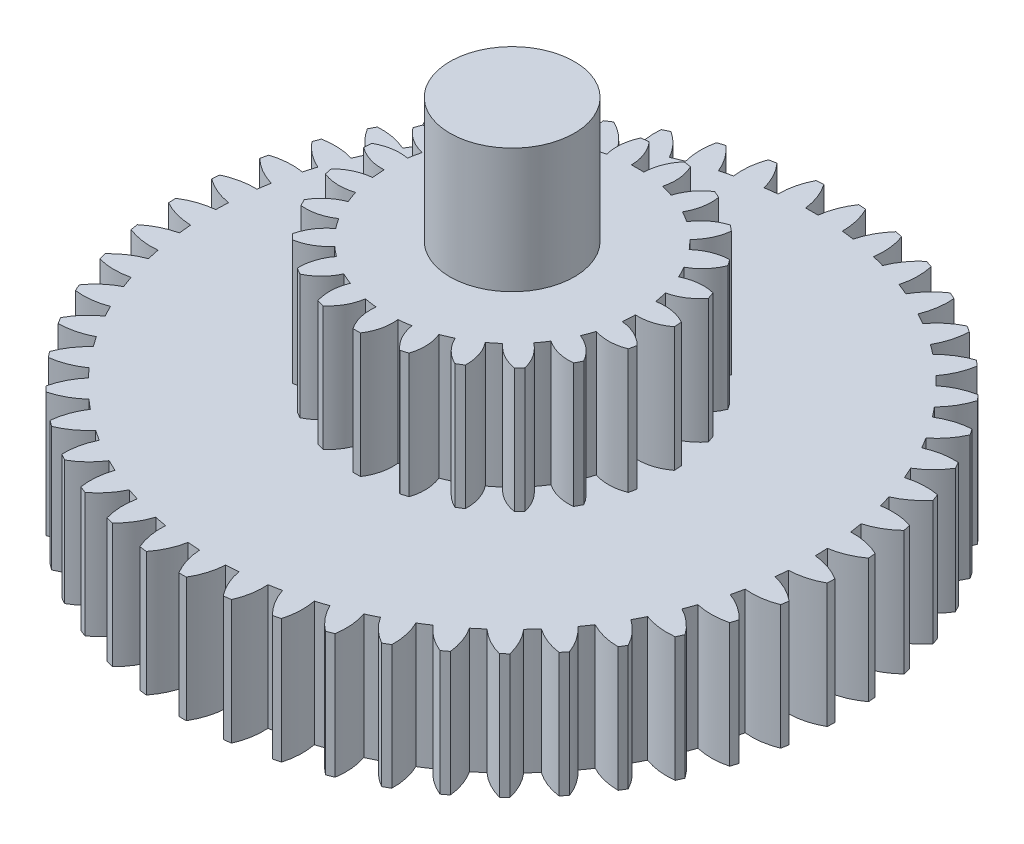
from build123d import *

# Parameters (mm, degrees)
BOSS_EXTRUDE1_DEPTH      = 1
BOSS_EXTRUDE2_DEPTH      = 2
BOSS_EXTRUDE2_DEPTH_BACK = 2
SKETCH2_R                = 0.5
BOSS_EXTRUDE3_DEPTH      = 1


with BuildPart() as part:
    # Sketch1 → Boss-Extrude1 (new body)
    with BuildSketch(Plane(origin=(0, 0, 0), x_dir=(1, 0, 0), z_dir=(0, 1, 0))):
        with BuildLine():
            ThreePointArc((-2.476479155, 0.943160111), (-2.486941318, 0.915217394), (-2.497088209, 0.887158654))
            ThreePointArc((-2.497088209, 0.887158654), (-2.405681699, 0.798131231), (-2.295665859, 0.733497284))
            ThreePointArc((-2.295665859, 0.733497284), (-2.310389526, 0.685711484), (-2.324118617, 0.637630499))
            ThreePointArc((-2.324118617, 0.637630499), (-2.451581658, 0.643479038), (-2.576755933, 0.618731655))
            ThreePointArc((-2.576755933, 0.618731655), (-2.583558967, 0.589680475), (-2.59003448, 0.560554541))
            ThreePointArc((-2.59003448, 0.560554541), (-2.487993842, 0.483946837), (-2.370616024, 0.433912047))
            ThreePointArc((-2.370616024, 0.433912047), (-2.379108098, 0.384635747), (-2.386576014, 0.335193869))
            ThreePointArc((-2.386576014, 0.335193869), (-2.513740479, 0.324694779), (-2.63472245, 0.284143641))
            ThreePointArc((-2.63472245, 0.284143641), (-2.637754649, 0.254461019), (-2.640452456, 0.224746138))
            ThreePointArc((-2.640452456, 0.224746138), (-2.529453195, 0.161816049), (-2.406640741, 0.127201987))
            ThreePointArc((-2.406640741, 0.127201987), (-2.408761781, 0.077244302), (-2.409845898, 0.027253365))
            ThreePointArc((-2.409845898, 0.027253365), (-2.534623752, 0.000579042), (-2.649426898, -0.055110003))
            ThreePointArc((-2.649426898, -0.055110003), (-2.648638473, -0.084936681), (-2.647514276, -0.114752591))
            ThreePointArc((-2.647514276, -0.114752591), (-2.529378996, -0.162971754), (-2.403148482, -0.181596727))
            ThreePointArc((-2.403148482, -0.181596727), (-2.398863662, -0.231415492), (-2.39354618, -0.281134638))
            ThreePointArc((-2.39354618, -0.281134638), (-2.513888572, -0.323546203), (-2.620627829, -0.393458742))
            ThreePointArc((-2.620627829, -0.393458742), (-2.616031726, -0.422939722), (-2.611103985, -0.452367085))
            ThreePointArc((-2.611103985, -0.452367085), (-2.487772464, -0.485083565), (-2.360196593, -0.487413627))
            ThreePointArc((-2.360196593, -0.487413627), (-2.349576268, -0.536275451), (-2.337944499, -0.584906419))
            ThreePointArc((-2.337944499, -0.584906419), (-2.451875411, -0.642358829), (-2.548798124, -0.7253469))
            ThreePointArc((-2.548798124, -0.7253469), (-2.540469811, -0.753998105), (-2.531819439, -0.782553724))
            ThreePointArc((-2.531819439, -0.782553724), (-2.405316777, -0.799230317), (-2.27849034, -0.78522721))
            ThreePointArc((-2.27849034, -0.78522721), (-2.261708897, -0.832329781), (-2.243953835, -0.879074052))
            ThreePointArc((-2.243953835, -0.879074052), (-2.349602524, -0.95062394), (-2.435117223, -1.045324882))
            ThreePointArc((-2.435117223, -1.045324882), (-2.423193451, -1.072675859), (-2.410962487, -1.099890852))
            ThreePointArc((-2.410962487, -1.099890852), (-2.283365855, -1.100253729), (-2.159371339, -1.070147383))
            ThreePointArc((-2.159371339, -1.070147383), (-2.136704328, -1.114717279), (-2.11311751, -1.158807313))
            ThreePointArc((-2.11311751, -1.158807313), (-2.208749229, -1.243279832), (-2.281451766, -1.348138658))
            ThreePointArc((-2.281451766, -1.348138658), (-2.266128322, -1.373740306), (-2.250517598, -1.399167803))
            ThreePointArc((-2.250517598, -1.399167803), (-2.123922129, -1.383211006), (-2.00479552, -1.337495765))
            ThreePointArc((-2.00479552, -1.337495765), (-1.976615134, -1.378801151), (-1.947583854, -1.419512991))
            ThreePointArc((-1.947583854, -1.419512991), (-2.031628332, -1.515521104), (-2.090324933, -1.628816034))
            ThreePointArc((-2.090324933, -1.628816034), (-2.071853429, -1.652247975), (-2.053119272, -1.675470458))
            ThreePointArc((-2.053119272, -1.675470458), (-1.92960366, -1.643455996), (-1.817301015, -1.582882504))
            ThreePointArc((-1.817301015, -1.582882504), (-1.784069973, -1.620245146), (-1.750070925, -1.656910304))
            ThreePointArc((-1.750070925, -1.656910304), (-1.821148154, -1.762877562), (-1.864875023, -1.882748297))
            ThreePointArc((-1.864875023, -1.882748297), (-1.843558759, -1.903625778), (-1.822008785, -1.924261933))
            ThreePointArc((-1.822008785, -1.924261933), (-1.703601153, -1.876715485), (-1.599966476, -1.802278357))
            ThreePointArc((-1.599966476, -1.802278357), (-1.562230433, -1.83508476), (-1.523821881, -1.867101196))
            ThreePointArc((-1.523821881, -1.867101196), (-1.580764774, -1.981287618), (-1.608803916, -2.105765884))
            ThreePointArc((-1.608803916, -2.105765884), (-1.584992906, -2.123746098), (-1.560980963, -2.141457081))
            ThreePointArc((-1.560980963, -2.141457081), (-1.449625561, -2.079159357), (-1.356360533, -1.992080848))
            ThreePointArc((-1.356360533, -1.992080848), (-1.314739112, -2.019792333), (-1.272551722, -2.046634338))
            ThreePointArc((-1.272551722, -2.046634338), (-1.31442528, -2.167164987), (-1.326316294, -2.294206854))
            ThreePointArc((-1.326316294, -2.294206854), (-1.300401513, -2.308994566), (-1.274321878, -2.323489563))
            ThreePointArc((-1.274321878, -2.323489563), (-1.171847158, -2.247463489), (-1.090483187, -2.149173427))
            ThreePointArc((-1.090483187, -2.149173427), (-1.045659811, -2.171334972), (-1.0003863, -2.192561801))
            ThreePointArc((-1.0003863, -2.192561801), (-1.026502959, -2.317457566), (-1.022050595, -2.44497701))
            ThreePointArc((-1.022050595, -2.44497701), (-0.994457563, -2.456329407), (-0.966738462, -2.467370411))
            ThreePointArc((-0.966738462, -2.467370411), (-0.874827057, -2.378864334), (-0.806700137, -2.270976638))
            ThreePointArc((-0.806700137, -2.270976638), (-0.759410805, -2.28722435), (-0.711794563, -2.302487459))
            ThreePointArc((-0.711794563, -2.302487459), (-0.721725488, -2.429697557), (-0.701002853, -2.555600712))
            ThreePointArc((-0.701002853, -2.555600712), (-0.672184647, -2.563331387), (-0.643281228, -2.570737105))
            ThreePointArc((-0.643281228, -2.570737105), (-0.56344232, -2.471204291), (-0.509671094, -2.355490475))
            ThreePointArc((-0.509671094, -2.355490475), (-0.460692295, -2.365557568), (-0.411515178, -2.374606338))
            ThreePointArc((-0.411515178, -2.374606338), (-0.405097304, -2.50204198), (-0.368444664, -2.624261521))
            ThreePointArc((-0.368444664, -2.624261521), (-0.338874478, -2.628243537), (-0.309261333, -2.631892366))
            ThreePointArc((-0.309261333, -2.631892366), (-0.242805876, -2.522967143), (-0.204273265, -2.401327223))
            ThreePointArc((-0.204273265, -2.401327223), (-0.15440923, -2.405048397), (-0.104478725, -2.407734245))
            ThreePointArc((-0.104478725, -2.407734245), (-0.081817434, -2.533302944), (-0.029836623, -2.649832028))
            ThreePointArc((-0.029836623, -2.649832028), (0, -2.65), (0.029836623, -2.649832028))
            ThreePointArc((0.029836623, -2.649832028), (0.081817434, -2.533302944), (0.104478725, -2.407734245))
            ThreePointArc((0.104478725, -2.407734245), (0.15440923, -2.405048397), (0.204273265, -2.401327223))
            ThreePointArc((0.204273265, -2.401327223), (0.242805876, -2.522967143), (0.309261333, -2.631892366))
            ThreePointArc((0.309261333, -2.631892366), (0.338874478, -2.628243537), (0.368444664, -2.624261521))
            ThreePointArc((0.368444664, -2.624261521), (0.405097304, -2.50204198), (0.411515178, -2.374606338))
            ThreePointArc((0.411515178, -2.374606338), (0.460692295, -2.365557568), (0.509671094, -2.355490475))
            ThreePointArc((0.509671094, -2.355490475), (0.56344232, -2.471204291), (0.643281228, -2.570737105))
            ThreePointArc((0.643281228, -2.570737105), (0.672184647, -2.563331387), (0.701002853, -2.555600712))
            ThreePointArc((0.701002853, -2.555600712), (0.721725488, -2.429697557), (0.711794563, -2.302487459))
            ThreePointArc((0.711794563, -2.302487459), (0.759410805, -2.28722435), (0.806700137, -2.270976638))
            ThreePointArc((0.806700137, -2.270976638), (0.874827057, -2.378864334), (0.966738462, -2.467370411))
            ThreePointArc((0.966738462, -2.467370411), (0.994457563, -2.456329407), (1.022050595, -2.44497701))
            ThreePointArc((1.022050595, -2.44497701), (1.026502959, -2.317457566), (1.0003863, -2.192561801))
            ThreePointArc((1.0003863, -2.192561801), (1.045659811, -2.171334972), (1.090483187, -2.149173427))
            ThreePointArc((1.090483187, -2.149173427), (1.171847158, -2.247463489), (1.274321878, -2.323489563))
            ThreePointArc((1.274321878, -2.323489563), (1.300401513, -2.308994566), (1.326316294, -2.294206854))
            ThreePointArc((1.326316294, -2.294206854), (1.31442528, -2.167164987), (1.272551722, -2.046634338))
            ThreePointArc((1.272551722, -2.046634338), (1.314739112, -2.019792333), (1.356360533, -1.992080848))
            ThreePointArc((1.356360533, -1.992080848), (1.449625561, -2.079159357), (1.560980963, -2.141457081))
            ThreePointArc((1.560980963, -2.141457081), (1.584992906, -2.123746098), (1.608803916, -2.105765884))
            ThreePointArc((1.608803916, -2.105765884), (1.580764774, -1.981287618), (1.523821881, -1.867101196))
            ThreePointArc((1.523821881, -1.867101196), (1.562230433, -1.83508476), (1.599966476, -1.802278357))
            ThreePointArc((1.599966476, -1.802278357), (1.703601153, -1.876715485), (1.822008785, -1.924261933))
            ThreePointArc((1.822008785, -1.924261933), (1.843558759, -1.903625778), (1.864875023, -1.882748297))
            ThreePointArc((1.864875023, -1.882748297), (1.821148154, -1.762877562), (1.750070925, -1.656910304))
            ThreePointArc((1.750070925, -1.656910304), (1.784069973, -1.620245146), (1.817301015, -1.582882504))
            ThreePointArc((1.817301015, -1.582882504), (1.92960366, -1.643455996), (2.053119272, -1.675470458))
            ThreePointArc((2.053119272, -1.675470458), (2.071853429, -1.652247975), (2.090324933, -1.628816034))
            ThreePointArc((2.090324933, -1.628816034), (2.031628332, -1.515521104), (1.947583854, -1.419512991))
            ThreePointArc((1.947583854, -1.419512991), (1.976615134, -1.378801151), (2.00479552, -1.337495765))
            ThreePointArc((2.00479552, -1.337495765), (2.123922129, -1.383211006), (2.250517598, -1.399167803))
            ThreePointArc((2.250517598, -1.399167803), (2.266128322, -1.373740306), (2.281451766, -1.348138658))
            ThreePointArc((2.281451766, -1.348138658), (2.208749229, -1.243279832), (2.11311751, -1.158807313))
            ThreePointArc((2.11311751, -1.158807313), (2.136704328, -1.114717279), (2.159371339, -1.070147383))
            ThreePointArc((2.159371339, -1.070147383), (2.283365855, -1.100253729), (2.410962487, -1.099890852))
            ThreePointArc((2.410962487, -1.099890852), (2.423193451, -1.072675859), (2.435117223, -1.045324882))
            ThreePointArc((2.435117223, -1.045324882), (2.349602524, -0.95062394), (2.243953835, -0.879074052))
            ThreePointArc((2.243953835, -0.879074052), (2.261708897, -0.832329781), (2.27849034, -0.78522721))
            ThreePointArc((2.27849034, -0.78522721), (2.405316777, -0.799230317), (2.531819439, -0.782553724))
            ThreePointArc((2.531819439, -0.782553724), (2.540469811, -0.753998105), (2.548798124, -0.7253469))
            ThreePointArc((2.548798124, -0.7253469), (2.451875411, -0.642358829), (2.337944499, -0.584906419))
            ThreePointArc((2.337944499, -0.584906419), (2.349576268, -0.536275451), (2.360196593, -0.487413627))
            ThreePointArc((2.360196593, -0.487413627), (2.487772464, -0.485083565), (2.611103985, -0.452367085))
            ThreePointArc((2.611103985, -0.452367085), (2.616031726, -0.422939722), (2.620627829, -0.393458742))
            ThreePointArc((2.620627829, -0.393458742), (2.513888572, -0.323546203), (2.39354618, -0.281134638))
            ThreePointArc((2.39354618, -0.281134638), (2.398863662, -0.231415492), (2.403148482, -0.181596727))
            ThreePointArc((2.403148482, -0.181596727), (2.529378996, -0.162971754), (2.647514276, -0.114752591))
            ThreePointArc((2.647514276, -0.114752591), (2.648638473, -0.084936681), (2.649426898, -0.055110003))
            ThreePointArc((2.649426898, -0.055110003), (2.534623752, 0.000579042), (2.409845898, 0.027253365))
            ThreePointArc((2.409845898, 0.027253365), (2.408761781, 0.077244302), (2.406640741, 0.127201987))
            ThreePointArc((2.406640741, 0.127201987), (2.529453195, 0.161816049), (2.640452456, 0.224746138))
            ThreePointArc((2.640452456, 0.224746138), (2.637754649, 0.254461019), (2.63472245, 0.284143641))
            ThreePointArc((2.63472245, 0.284143641), (2.513740479, 0.324694779), (2.386576014, 0.335193869))
            ThreePointArc((2.386576014, 0.335193869), (2.379108098, 0.384635747), (2.370616024, 0.433912047))
            ThreePointArc((2.370616024, 0.433912047), (2.487993842, 0.483946837), (2.59003448, 0.560554541))
            ThreePointArc((2.59003448, 0.560554541), (2.583558967, 0.589680475), (2.576755933, 0.618731655))
            ThreePointArc((2.576755933, 0.618731655), (2.451581658, 0.643479038), (2.324118617, 0.637630499))
            ThreePointArc((2.324118617, 0.637630499), (2.310389526, 0.685711484), (2.295665859, 0.733497284))
            ThreePointArc((2.295665859, 0.733497284), (2.405681699, 0.798131231), (2.497088209, 0.887158654))
            ThreePointArc((2.497088209, 0.887158654), (2.486941318, 0.915217394), (2.476479155, 0.943160111))
            ThreePointArc((2.476479155, 0.943160111), (2.349167934, 0.951697388), (2.223499257, 0.929597253))
            ThreePointArc((2.223499257, 0.929597253), (2.203734421, 0.975527857), (2.183020923, 1.021038516))
            ThreePointArc((2.183020923, 1.021038516), (2.283868329, 1.099210332), (2.363139819, 1.199195646))
            ThreePointArc((2.363139819, 1.199195646), (2.349488162, 1.225726469), (2.335538657, 1.252101905))
            ThreePointArc((2.335538657, 1.252101905), (2.208180937, 1.244288893), (2.086370101, 1.206300047))
            ThreePointArc((2.086370101, 1.206300047), (2.060894059, 1.24932609), (2.034530844, 1.291814323))
            ThreePointArc((2.034530844, 1.291814323), (2.124553904, 1.38224043), (2.190388738, 1.491541879))
            ThreePointArc((2.190388738, 1.491541879), (2.173456475, 1.516109149), (2.156248679, 1.54048422))
            ThreePointArc((2.156248679, 1.54048422), (2.03093567, 1.516449209), (1.914982805, 1.463195427))
            ThreePointArc((1.914982805, 1.463195427), (1.884213873, 1.502610422), (1.852633825, 1.541378575))
            ThreePointArc((1.852633825, 1.541378575), (1.930354363, 1.642574178), (1.981671535, 1.759397036))
            ThreePointArc((1.981671535, 1.759397036), (1.961736692, 1.781597359), (1.941553158, 1.803571827))
            ThreePointArc((1.941553158, 1.803571827), (1.820342495, 1.763709471), (1.712151544, 1.696065178))
            ThreePointArc((1.712151544, 1.696065178), (1.676594947, 1.731221934), (1.640316609, 1.765633433))
            ThreePointArc((1.640316609, 1.765633433), (1.704458457, 1.875936904), (1.74041534, 1.998362941))
            ThreePointArc((1.74041534, 1.998362941), (1.717805248, 2.01783179), (1.694977387, 2.037044835))
            ThreePointArc((1.694977387, 2.037044835), (1.579859347, 1.982009672), (1.481206803, 1.901085586))
            ThreePointArc((1.481206803, 1.901085586), (1.441446378, 1.931406829), (1.401065441, 1.96089664))
            ThreePointArc((1.401065441, 1.96089664), (1.45057539, 2.078496797), (1.470581573, 2.204515783))
            ThreePointArc((1.470581573, 2.204515783), (1.445667488, 2.220933478), (1.420570134, 2.237069622))
            ThreePointArc((1.420570134, 2.237069622), (1.313434953, 2.167765329), (1.225940687, 2.074890222))
            ThreePointArc((1.225940687, 2.074890222), (1.1826293, 2.099878077), (1.138808816, 2.123961977))
            ThreePointArc((1.138808816, 2.123961977), (1.172873915, 2.246927831), (1.176600897, 2.374470537))
            ThreePointArc((1.176600897, 2.374470537), (1.149791909, 2.3875675), (1.122837159, 2.400361788))
            ThreePointArc((1.122837159, 2.400361788), (1.025443992, 2.31792634), (0.950544658, 2.214625217))
            ThreePointArc((0.950544658, 2.214625217), (0.904393482, 2.233869385), (0.857852982, 2.252151918))
            ThreePointArc((0.857852982, 2.252151918), (0.875913883, 2.378464372), (0.863300467, 2.505436549))
            ThreePointArc((0.863300467, 2.505436549), (0.835036778, 2.51499773), (0.806667229, 2.52424008))
            ThreePointArc((0.806667229, 2.52424008), (0.72061527, 2.430027064), (0.659540713, 2.317996128))
            ThreePointArc((0.659540713, 2.317996128), (0.611307547, 2.33118062), (0.562811226, 2.343361586))
            ThreePointArc((0.562811226, 2.343361586), (0.564571369, 2.470946593), (0.535824668, 2.595263363))
            ThreePointArc((0.535824668, 2.595263363), (0.506570366, 2.601131766), (0.477251846, 2.606670419))
            ThreePointArc((0.477251846, 2.606670419), (0.403954065, 2.50222681), (0.357707127, 2.383305606))
            ThreePointArc((0.357707127, 2.383305606), (0.30818396, 2.390213933), (0.258528126, 2.396093322))
            ThreePointArc((0.258528126, 2.396093322), (0.243958609, 2.52285594), (0.199550642, 2.642476025))
            ThreePointArc((0.199550642, 2.642476025), (0.169786083, 2.644555291), (0.14, 2.646299303))
            ThreePointArc((0.14, 2.646299303), (0.080659945, 2.533340062), (0.05, 2.409481272))
            ThreePointArc((0.05, 2.409481272), (0, 2.41), (-0.05, 2.409481272))
            ThreePointArc((-0.05, 2.409481272), (-0.080659945, 2.533340062), (-0.14, 2.646299303))
            ThreePointArc((-0.14, 2.646299303), (-0.169786083, 2.644555291), (-0.199550642, 2.642476025))
            ThreePointArc((-0.199550642, 2.642476025), (-0.243958609, 2.52285594), (-0.258528126, 2.396093322))
            ThreePointArc((-0.258528126, 2.396093322), (-0.30818396, 2.390213933), (-0.357707127, 2.383305606))
            ThreePointArc((-0.357707127, 2.383305606), (-0.403954065, 2.50222681), (-0.477251846, 2.606670419))
            ThreePointArc((-0.477251846, 2.606670419), (-0.506570366, 2.601131766), (-0.535824668, 2.595263363))
            ThreePointArc((-0.535824668, 2.595263363), (-0.564571369, 2.470946593), (-0.562811226, 2.343361586))
            ThreePointArc((-0.562811226, 2.343361586), (-0.611307547, 2.33118062), (-0.659540713, 2.317996128))
            ThreePointArc((-0.659540713, 2.317996128), (-0.72061527, 2.430027064), (-0.806667229, 2.52424008))
            ThreePointArc((-0.806667229, 2.52424008), (-0.835036778, 2.51499773), (-0.863300467, 2.505436549))
            ThreePointArc((-0.863300467, 2.505436549), (-0.875913883, 2.378464372), (-0.857852982, 2.252151918))
            ThreePointArc((-0.857852982, 2.252151918), (-0.904393482, 2.233869385), (-0.950544658, 2.214625217))
            ThreePointArc((-0.950544658, 2.214625217), (-1.025443992, 2.31792634), (-1.122837159, 2.400361788))
            ThreePointArc((-1.122837159, 2.400361788), (-1.149791909, 2.3875675), (-1.176600897, 2.374470537))
            ThreePointArc((-1.176600897, 2.374470537), (-1.172873915, 2.246927831), (-1.138808816, 2.123961977))
            ThreePointArc((-1.138808816, 2.123961977), (-1.1826293, 2.099878077), (-1.225940687, 2.074890222))
            ThreePointArc((-1.225940687, 2.074890222), (-1.313434953, 2.167765329), (-1.420570134, 2.237069622))
            ThreePointArc((-1.420570134, 2.237069622), (-1.445667488, 2.220933478), (-1.470581573, 2.204515783))
            ThreePointArc((-1.470581573, 2.204515783), (-1.45057539, 2.078496797), (-1.401065441, 1.96089664))
            ThreePointArc((-1.401065441, 1.96089664), (-1.441446378, 1.931406829), (-1.481206803, 1.901085586))
            ThreePointArc((-1.481206803, 1.901085586), (-1.579859347, 1.982009672), (-1.694977387, 2.037044835))
            ThreePointArc((-1.694977387, 2.037044835), (-1.717805248, 2.01783179), (-1.74041534, 1.998362941))
            ThreePointArc((-1.74041534, 1.998362941), (-1.704458457, 1.875936904), (-1.640316609, 1.765633433))
            ThreePointArc((-1.640316609, 1.765633433), (-1.676594947, 1.731221934), (-1.712151544, 1.696065178))
            ThreePointArc((-1.712151544, 1.696065178), (-1.820342495, 1.763709471), (-1.941553158, 1.803571827))
            ThreePointArc((-1.941553158, 1.803571827), (-1.961736692, 1.781597359), (-1.981671535, 1.759397036))
            ThreePointArc((-1.981671535, 1.759397036), (-1.930354363, 1.642574178), (-1.852633825, 1.541378575))
            ThreePointArc((-1.852633825, 1.541378575), (-1.884213873, 1.502610422), (-1.914982805, 1.463195427))
            ThreePointArc((-1.914982805, 1.463195427), (-2.03093567, 1.516449209), (-2.156248679, 1.54048422))
            ThreePointArc((-2.156248679, 1.54048422), (-2.173456475, 1.516109149), (-2.190388738, 1.491541879))
            ThreePointArc((-2.190388738, 1.491541879), (-2.124553904, 1.38224043), (-2.034530844, 1.291814323))
            ThreePointArc((-2.034530844, 1.291814323), (-2.060894059, 1.24932609), (-2.086370101, 1.206300047))
            ThreePointArc((-2.086370101, 1.206300047), (-2.208180937, 1.244288893), (-2.335538657, 1.252101905))
            ThreePointArc((-2.335538657, 1.252101905), (-2.349488162, 1.225726469), (-2.363139819, 1.199195646))
            ThreePointArc((-2.363139819, 1.199195646), (-2.283868329, 1.099210332), (-2.183020923, 1.021038516))
            ThreePointArc((-2.183020923, 1.021038516), (-2.203734421, 0.975527857), (-2.223499257, 0.929597253))
            ThreePointArc((-2.223499257, 0.929597253), (-2.349167934, 0.951697388), (-2.476479155, 0.943160111))
        make_face()
    extrude(amount=BOSS_EXTRUDE1_DEPTH)

    # Sketch2 → Boss-Extrude2 (add, two sides: drawn at the far end of the back side and taken through both)
    with BuildSketch(Plane(origin=(0, 1, 0), x_dir=(1, 0, 0), z_dir=(0, 1, 0)).offset(-BOSS_EXTRUDE2_DEPTH_BACK)):
        with Locations(Location((0, 0, 0), (0, 0, 270))):
            Circle(SKETCH2_R)
    extrude(amount=BOSS_EXTRUDE2_DEPTH + BOSS_EXTRUDE2_DEPTH_BACK)

    # Sketch3 → Boss-Extrude3 (add)
    with BuildSketch(Plane(origin=(0, 1, 0), x_dir=(1, 0, 0), z_dir=(0, 1, 0))):
        with BuildLine():
            ThreePointArc((-1.16728264, 0.447159074), (-1.177826153, 0.418599515), (-1.187671024, 0.38979166))
            ThreePointArc((-1.187671024, 0.38979166), (-1.094599992, 0.303361491), (-0.977489647, 0.254192821))
            ThreePointArc((-0.977489647, 0.254192821), (-0.988874929, 0.205490573), (-0.997835248, 0.156284412))
            ThreePointArc((-0.997835248, 0.156284412), (-1.124839032, 0.157843241), (-1.244638708, 0.115648115))
            ThreePointArc((-1.244638708, 0.115648115), (-1.247085961, 0.085303017), (-1.248793492, 0.05490732))
            ThreePointArc((-1.248793492, 0.05490732), (-1.135855206, -0.003207519), (-1.009822082, -0.018956889))
            ThreePointArc((-1.009822082, -0.018956889), (-1.007645457, -0.068924837), (-1.00299784, -0.118723766))
            ThreePointArc((-1.00299784, -0.118723766), (-1.125712546, -0.151487953), (-1.229685616, -0.224439935))
            ThreePointArc((-1.229685616, -0.224439935), (-1.22385511, -0.254320016), (-1.21729866, -0.284049244))
            ThreePointArc((-1.21729866, -0.284049244), (-1.092869235, -0.309538643), (-0.967260632, -0.290700653))
            ThreePointArc((-0.967260632, -0.290700653), (-0.951683531, -0.338228408), (-0.933772671, -0.384926745))
            ThreePointArc((-0.933772671, -0.384926745), (-1.043097111, -0.449583979), (-1.123532368, -0.547882303))
            ThreePointArc((-1.123532368, -0.547882303), (-1.109856523, -0.575081297), (-1.095522354, -0.601939176))
            ThreePointArc((-1.095522354, -0.601939176), (-0.968830153, -0.592912701), (-0.852961886, -0.54088448))
            ThreePointArc((-0.852961886, -0.54088448), (-0.825139592, -0.582447125), (-0.795293854, -0.622581469))
            ThreePointArc((-0.795293854, -0.622581469), (-0.883119934, -0.714336418), (-0.934051864, -0.830690746))
            ThreePointArc((-0.934051864, -0.830690746), (-0.913544955, -0.853191429), (-0.892496167, -0.875186032))
            ThreePointArc((-0.892496167, -0.875186032), (-0.772937371, -0.832313137), (-0.67540286, -0.750953379))
            ThreePointArc((-0.67540286, -0.750953379), (-0.637398824, -0.783468404), (-0.597831731, -0.814062173))
            ThreePointArc((-0.597831731, -0.814062173), (-0.657645793, -0.926109793), (-0.675297006, -1.051890657))
            ThreePointArc((-0.675297006, -1.051890657), (-0.649479938, -1.068024256), (-0.623277623, -1.083524344))
            ThreePointArc((-0.623277623, -1.083524344), (-0.519719359, -1.009984715), (-0.447752293, -0.905327501))
            ThreePointArc((-0.447752293, -0.905327501), (-0.402385101, -0.926383415), (-0.356031163, -0.94516761))
            ThreePointArc((-0.356031163, -0.94516761), (-0.383397071, -1.069197841), (-0.366458458, -1.19507665))
            ThreePointArc((-0.366458458, -1.19507665), (-0.337245964, -1.203646609), (-0.307833428, -1.211502613))
            ThreePointArc((-0.307833428, -1.211502613), (-0.227956141, -1.112750347), (-0.186893986, -0.992557624))
            ThreePointArc((-0.186893986, -0.992557624), (-0.137528316, -1.000592805), (-0.087825392, -1.006174289))
            ThreePointArc((-0.087825392, -1.006174289), (-0.080713542, -1.132988376), (-0.030441363, -1.249629274))
            ThreePointArc((-0.030441363, -1.249629274), (0, -1.25), (0.030441363, -1.249629274))
            ThreePointArc((0.030441363, -1.249629274), (0.080713542, -1.132988376), (0.087825392, -1.006174289))
            ThreePointArc((0.087825392, -1.006174289), (0.137528316, -1.000592805), (0.186893986, -0.992557624))
            ThreePointArc((0.186893986, -0.992557624), (0.227956141, -1.112750347), (0.307833428, -1.211502613))
            ThreePointArc((0.307833428, -1.211502613), (0.337245964, -1.203646609), (0.366458458, -1.19507665))
            ThreePointArc((0.366458458, -1.19507665), (0.383397071, -1.069197841), (0.356031163, -0.94516761))
            ThreePointArc((0.356031163, -0.94516761), (0.402385101, -0.926383415), (0.447752293, -0.905327501))
            ThreePointArc((0.447752293, -0.905327501), (0.519719359, -1.009984715), (0.623277623, -1.083524344))
            ThreePointArc((0.623277623, -1.083524344), (0.649479938, -1.068024256), (0.675297006, -1.051890657))
            ThreePointArc((0.675297006, -1.051890657), (0.657645793, -0.926109793), (0.597831731, -0.814062173))
            ThreePointArc((0.597831731, -0.814062173), (0.637398824, -0.783468404), (0.67540286, -0.750953379))
            ThreePointArc((0.67540286, -0.750953379), (0.772937371, -0.832313137), (0.892496167, -0.875186032))
            ThreePointArc((0.892496167, -0.875186032), (0.913544955, -0.853191429), (0.934051864, -0.830690746))
            ThreePointArc((0.934051864, -0.830690746), (0.883119934, -0.714336418), (0.795293854, -0.622581469))
            ThreePointArc((0.795293854, -0.622581469), (0.825139592, -0.582447125), (0.852961886, -0.54088448))
            ThreePointArc((0.852961886, -0.54088448), (0.968830153, -0.592912701), (1.095522354, -0.601939176))
            ThreePointArc((1.095522354, -0.601939176), (1.109856523, -0.575081297), (1.123532368, -0.547882303))
            ThreePointArc((1.123532368, -0.547882303), (1.043097111, -0.449583979), (0.933772671, -0.384926745))
            ThreePointArc((0.933772671, -0.384926745), (0.951683531, -0.338228408), (0.967260632, -0.290700653))
            ThreePointArc((0.967260632, -0.290700653), (1.092869235, -0.309538643), (1.21729866, -0.284049244))
            ThreePointArc((1.21729866, -0.284049244), (1.22385511, -0.254320016), (1.229685616, -0.224439935))
            ThreePointArc((1.229685616, -0.224439935), (1.125712546, -0.151487953), (1.00299784, -0.118723766))
            ThreePointArc((1.00299784, -0.118723766), (1.007645457, -0.068924837), (1.009822082, -0.018956889))
            ThreePointArc((1.009822082, -0.018956889), (1.135855206, -0.003207519), (1.248793492, 0.05490732))
            ThreePointArc((1.248793492, 0.05490732), (1.247085961, 0.085303017), (1.244638708, 0.115648115))
            ThreePointArc((1.244638708, 0.115648115), (1.124839032, 0.157843241), (0.997835248, 0.156284412))
            ThreePointArc((0.997835248, 0.156284412), (0.988874929, 0.205490573), (0.977489647, 0.254192821))
            ThreePointArc((0.977489647, 0.254192821), (1.094599992, 0.303361491), (1.187671024, 0.38979166))
            ThreePointArc((1.187671024, 0.38979166), (1.177826153, 0.418599515), (1.16728264, 0.447159074))
            ThreePointArc((1.16728264, 0.447159074), (1.040541353, 0.455467925), (0.918667781, 0.41970169))
            ThreePointArc((0.918667781, 0.41970169), (0.896764071, 0.464665688), (0.872661277, 0.508490212))
            ThreePointArc((0.872661277, 0.508490212), (0.972163304, 0.587431568), (1.03846443, 0.695766935))
            ThreePointArc((1.03846443, 0.695766935), (1.021212366, 0.720850403), (1.003354559, 0.74550629))
            ThreePointArc((1.003354559, 0.74550629), (0.879071481, 0.719312636), (0.771366926, 0.651991614))
            ThreePointArc((0.771366926, 0.651991614), (0.738144324, 0.689378675), (0.703111612, 0.725075211))
            ThreePointArc((0.703111612, 0.725075211), (0.777625711, 0.827934532), (0.812239679, 0.95014036))
            ThreePointArc((0.812239679, 0.95014036), (0.78885993, 0.969639113), (0.765012261, 0.988562715))
            ThreePointArc((0.765012261, 0.988562715), (0.652404899, 0.929809219), (0.566857316, 0.835926303))
            ThreePointArc((0.566857316, 0.835926303), (0.52477979, 0.862963599), (0.481415375, 0.887884698))
            ThreePointArc((0.481415375, 0.887884698), (0.525415177, 1.00703338), (0.525774827, 1.134046221))
            ThreePointArc((0.525774827, 1.134046221), (0.498001362, 1.146514127), (0.469932502, 1.158301966))
            ThreePointArc((0.469932502, 1.158301966), (0.377352431, 1.071346106), (0.320306492, 0.957864161))
            ThreePointArc((0.320306492, 0.957864161), (0.272494739, 0.97254646), (0.224014763, 0.984843838))
            ThreePointArc((0.224014763, 0.984843838), (0.234237003, 1.111445169), (0.200315662, 1.233845061))
            ThreePointArc((0.200315662, 1.233845061), (0.170208311, 1.238357433), (0.14, 1.242135258))
            ThreePointArc((0.14, 1.242135258), (0.074313459, 1.133426154), (0.05, 1.008761617))
            ThreePointArc((0.05, 1.008761617), (0, 1.01), (-0.05, 1.008761617))
            ThreePointArc((-0.05, 1.008761617), (-0.074313459, 1.133426154), (-0.14, 1.242135258))
            ThreePointArc((-0.14, 1.242135258), (-0.170208311, 1.238357433), (-0.200315662, 1.233845061))
            ThreePointArc((-0.200315662, 1.233845061), (-0.234237003, 1.111445169), (-0.224014763, 0.984843838))
            ThreePointArc((-0.224014763, 0.984843838), (-0.272494739, 0.97254646), (-0.320306492, 0.957864161))
            ThreePointArc((-0.320306492, 0.957864161), (-0.377352431, 1.071346106), (-0.469932502, 1.158301966))
            ThreePointArc((-0.469932502, 1.158301966), (-0.498001362, 1.146514127), (-0.525774827, 1.134046221))
            ThreePointArc((-0.525774827, 1.134046221), (-0.525415177, 1.00703338), (-0.481415375, 0.887884698))
            ThreePointArc((-0.481415375, 0.887884698), (-0.52477979, 0.862963599), (-0.566857316, 0.835926303))
            ThreePointArc((-0.566857316, 0.835926303), (-0.652404899, 0.929809219), (-0.765012261, 0.988562715))
            ThreePointArc((-0.765012261, 0.988562715), (-0.78885993, 0.969639113), (-0.812239679, 0.95014036))
            ThreePointArc((-0.812239679, 0.95014036), (-0.777625711, 0.827934532), (-0.703111612, 0.725075211))
            ThreePointArc((-0.703111612, 0.725075211), (-0.738144324, 0.689378675), (-0.771366926, 0.651991614))
            ThreePointArc((-0.771366926, 0.651991614), (-0.879071481, 0.719312636), (-1.003354559, 0.74550629))
            ThreePointArc((-1.003354559, 0.74550629), (-1.021212366, 0.720850403), (-1.03846443, 0.695766935))
            ThreePointArc((-1.03846443, 0.695766935), (-0.972163304, 0.587431568), (-0.872661277, 0.508490212))
            ThreePointArc((-0.872661277, 0.508490212), (-0.896764071, 0.464665688), (-0.918667781, 0.41970169))
            ThreePointArc((-0.918667781, 0.41970169), (-1.040541353, 0.455467925), (-1.16728264, 0.447159074))
        make_face()
    extrude(amount=BOSS_EXTRUDE3_DEPTH)


solid = part.part
